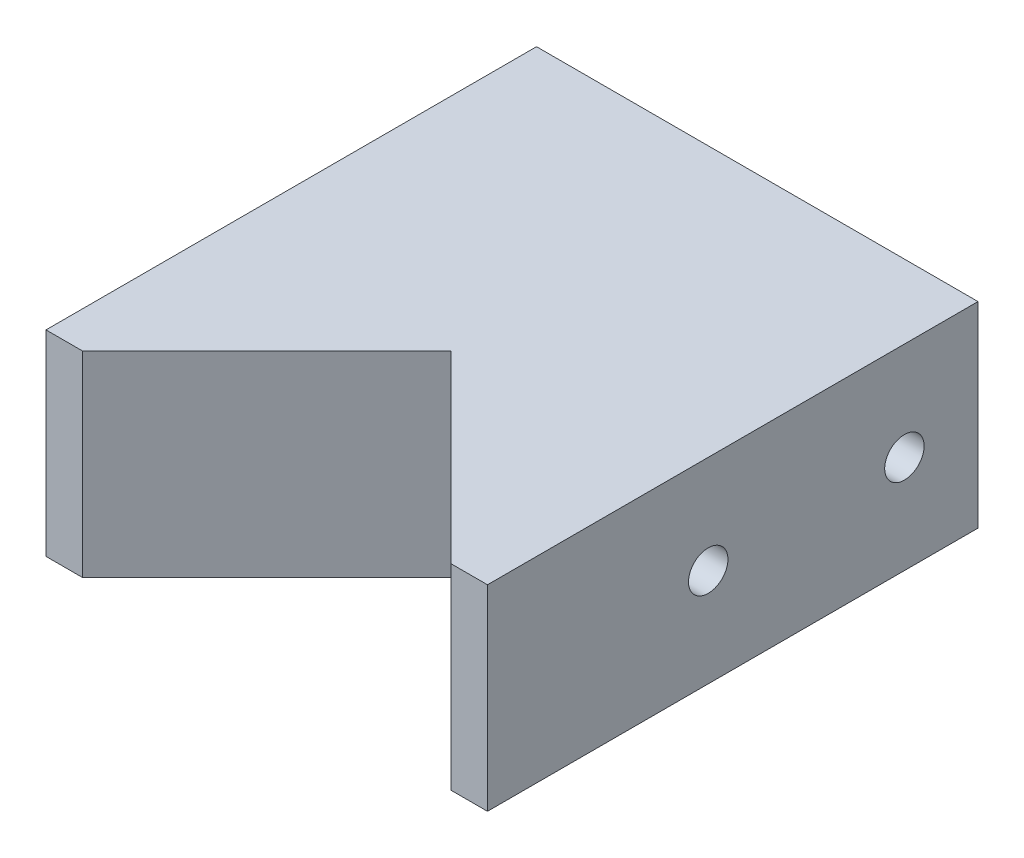
from build123d import *

# Parameters (mm, degrees)
SKETCH1_W               = 57.15
SKETCH1_H               = 25.4
BOSS_EXTRUDE1_DEPTH     = 63.5
F_1_4_20_TAPPED_HOLE1_D = 5.1054
CUT_EXTRUDE1_DEPTH      = 75.121121315


with BuildPart() as part:
    # Sketch1 → Boss-Extrude1 (new body)
    with BuildSketch(Plane.XY):
        Rectangle(SKETCH1_W, SKETCH1_H)
    extrude(amount=BOSS_EXTRUDE1_DEPTH)

    # 1/4-20 Tapped Hole1 (through all)
    with Locations(Plane(origin=(28.575, 0, 0), x_dir=(0, 0, -1), z_dir=(1, 0, 0))):
        with Locations((-34.925, 0), (-9.525, 0)):
            Hole(F_1_4_20_TAPPED_HOLE1_D / 2)

    # Sketch5 → Cut-Extrude1 (cut, through all)
    with BuildSketch(Plane(origin=(0, 12.7, 0), x_dir=(1, 0, 0), z_dir=(0, 1, 0))):
        Polygon((-23.8252, -63.5), (0, -39.6748), (23.8252, -63.5), align=None)
    extrude(amount=-CUT_EXTRUDE1_DEPTH, mode=Mode.SUBTRACT)


solid = part.part
